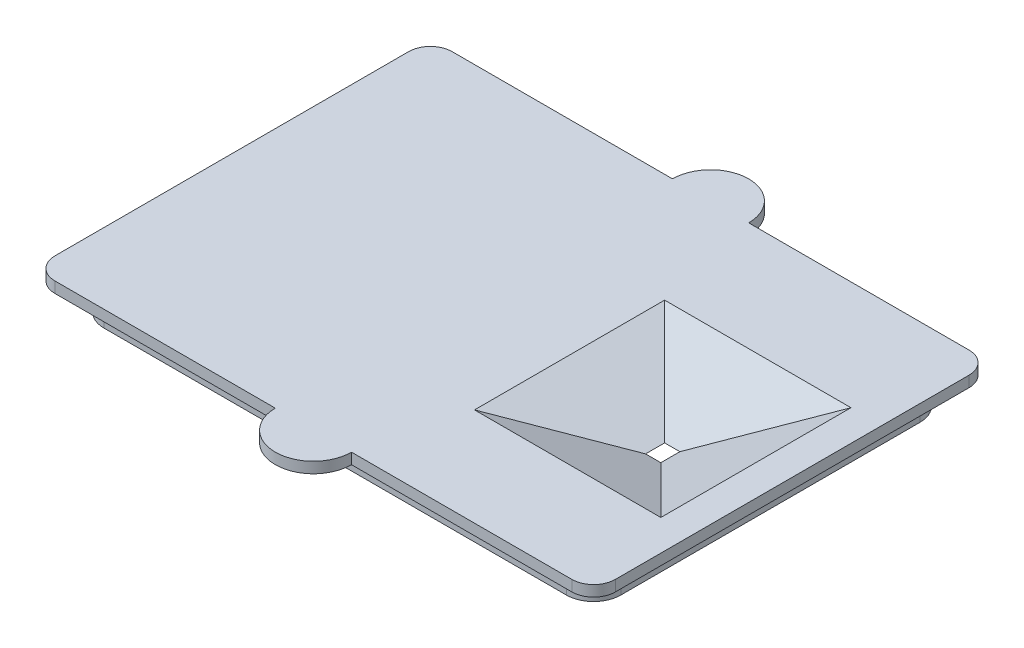
from build123d import *

# Parameters (mm, degrees)
SKETCH1_W           = 103
SKETCH1_H           = 73
BOSS_EXTRUDE1_DEPTH = 2
SKETCH2_W           = 95
SKETCH2_H           = 65
BOSS_EXTRUDE2_DEPTH = 5
BOSS_EXTRUDE3_DEPTH = 2
SKETCH12_W          = 2.8
SKETCH12_H          = 3.5
CUT_EXTRUDE3_DEPTH  = 7
CUT_EXTRUDE3_TAPER  = -66
FILLET4_R           = 4
CUT_EXTRUDE5_DEPTH  = 5
FILLET5_R           = 2
FILLET6_R           = 5


with BuildPart() as part:
    # Sketch1 → Boss-Extrude1 (new body)
    with BuildSketch(Plane(origin=(0, 0, 0), x_dir=(1, 0, 0), z_dir=(0, 1, 0))):
        Rectangle(SKETCH1_W, SKETCH1_H)
    extrude(amount=BOSS_EXTRUDE1_DEPTH)

    # Sketch2 → Boss-Extrude2 (add)
    with BuildSketch(Plane.XZ):
        Rectangle(SKETCH2_W, SKETCH2_H)
    extrude(amount=BOSS_EXTRUDE2_DEPTH)

    # Sketch3 → Boss-Extrude3 (add)
    with BuildSketch(Plane(origin=(0, 2, 0), x_dir=(1, 0, 0), z_dir=(0, 1, 0))):
        with BuildLine():
            Line((-7, -36.5), (7, -36.5))
            ThreePointArc((7, -36.5), (0, -43.5), (-7, -36.5))
        make_face()
    boss_extrude3 = extrude(amount=-BOSS_EXTRUDE3_DEPTH)

    # Mirror1: Boss-Extrude3 across plane
    add(boss_extrude3.mirror(Plane.XY))

    # Sketch12 → Cut-Extrude3 (cut)
    with BuildSketch(Plane.XZ.offset(5)):
        with Locations((28.702273545, 0.998760933)):
            Rectangle(SKETCH12_W, SKETCH12_H)
    extrude(amount=-CUT_EXTRUDE3_DEPTH, taper=CUT_EXTRUDE3_TAPER, mode=Mode.SUBTRACT)

    # Fillet4
    fillet4_edges = [part.edges().sort_by_distance(p)[0] for p in [
        (51.5, 1, 36.5),
        (-51.5, 1, 36.5),
        (-51.5, 1, -36.5),
        (51.5, 1, -36.5),
    ]]
    fillet(fillet4_edges, radius=FILLET4_R)

    # Sketch13 → Cut-Extrude5 (cut)
    with BuildSketch(Plane.XZ.offset(5)):
        with BuildLine():
            ThreePointArc((-9.102862796, -4.001239067), (-14.007432374, -8.905808645), (-9.102862796, -13.810378223))
            Line((-9.102862796, -13.810378223), (15.897137204, -13.810378223))
            Line((15.897137204, -13.810378223), (15.897137204, -23.810378223))
            Line((15.897137204, -23.810378223), (-9.102862796, -23.810378223))
            ThreePointArc((-9.102862796, -23.810378223), (-24.007432374, -8.905808645), (-9.102862796, 5.998760933))
            Line((-9.102862796, 5.998760933), (10.507409885, 5.998760933))
            Line((10.507409885, 5.998760933), (15.897137204, 5.998760933))
            Line((15.897137204, 5.998760933), (15.897137204, -4.001239067))
            Line((15.897137204, -4.001239067), (14.523166563, -4.001239067))
            Line((14.523166563, -4.001239067), (-9.102862796, -4.001239067))
        make_face()
    extrude(amount=-CUT_EXTRUDE5_DEPTH, mode=Mode.SUBTRACT)

    # Fillet5
    fillet5_edges = [part.edges().sort_by_distance(p)[0] for p in [
        (15.897137204, 0, -18.810378223),
        (15.897137204, 0, 0.998760933),
        (15.897137204, -5, -18.810378223),
        (15.897137204, -5, 0.998760933),
    ]]
    fillet(fillet5_edges, radius=FILLET5_R)

    # Fillet6
    fillet6_edges = [part.edges().sort_by_distance(p)[0] for p in [
        (-47.5, -2.5, -32.5),
        (47.5, -2.5, -32.5),
        (47.5, -2.5, 32.5),
        (-47.5, -2.5, 32.5),
    ]]
    fillet(fillet6_edges, radius=FILLET6_R)


solid = part.part
